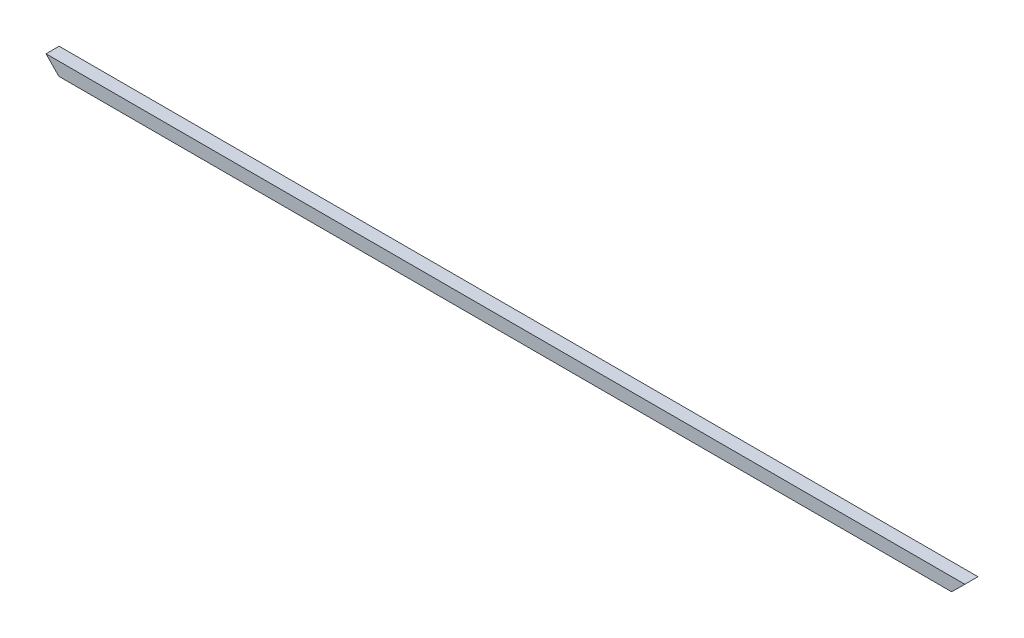
from build123d import *

# Parameters (mm, degrees)
BOSS_EXTRUDE1_DEPTH = 40


with BuildPart() as part:
    # Sketch2 → Boss-Extrude1 (new body)
    with BuildSketch(Plane.XY):
        Polygon((-2776.65074398, 0), (23.64925602, 0), (-16.771831658, -40), (-2737.425107633, -40), align=None)
    extrude(amount=BOSS_EXTRUDE1_DEPTH)


solid = part.part
